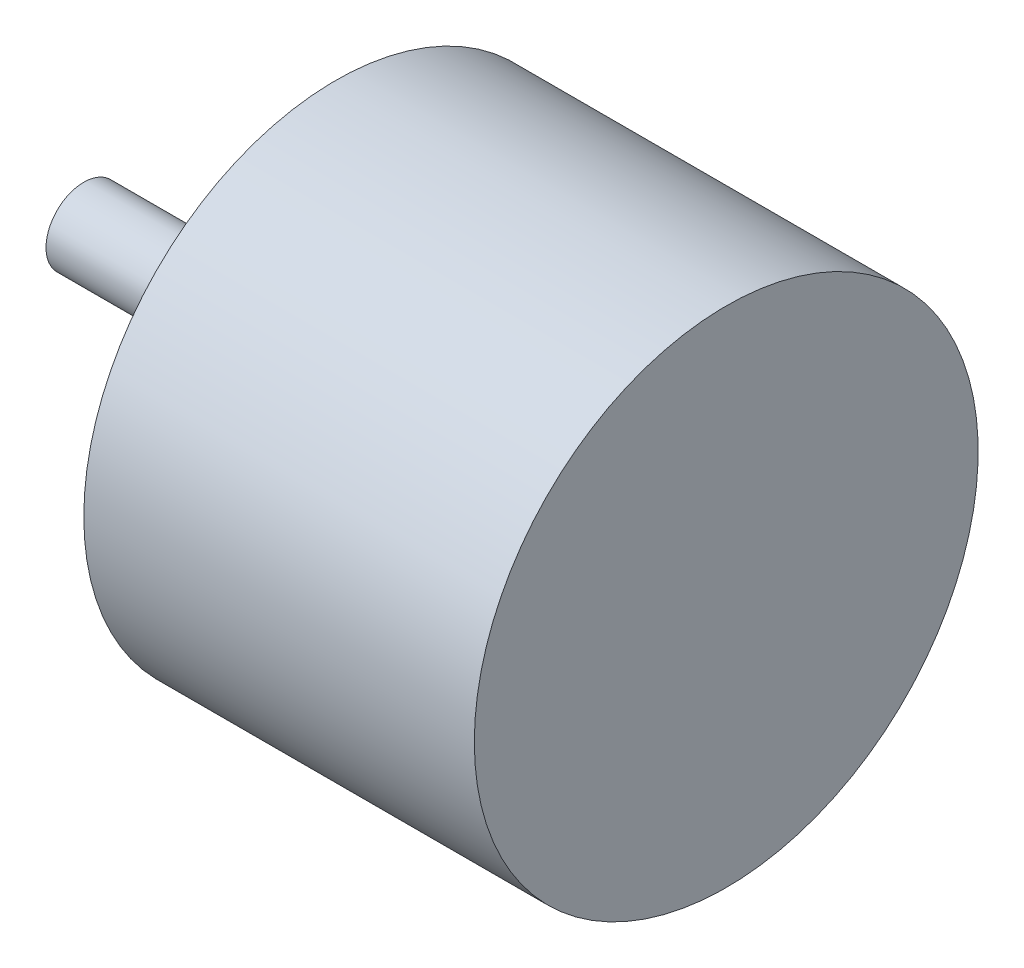
from build123d import *

# Parameters (mm, degrees)
SKETCH2_R          = 1.5
CUT_EXTRUDE1_DEPTH = 10


with BuildPart() as part:
    # Sketch1 → Revolve1 (revolve)
    with BuildSketch(Plane.XY, mode=Mode.PRIVATE) as revolve1_sk:
        Polygon((-24.5, 0), (-24.5, 3), (-9.5, 3), (-9.5, 10), (-4.5, 10), (-4.5, 20), (26.5, 20), (26.5, 0), align=None)
    revolve(revolve1_sk.sketch.rotate(Axis((-28.153846154, 0, 0), (1, 0, 0)), 90), axis=Axis((-28.153846154, 0, 0), (1, 0, 0)))

    # Sketch2 → Cut-Extrude1 (cut)
    with BuildSketch(Plane.ZY.offset(4.5)):
        with Locations((15, 0)):
            Circle(SKETCH2_R)
        with Locations((-7.5, -12.990381057)):
            Circle(SKETCH2_R)
        with Locations((-7.5, 12.990381057)):
            Circle(SKETCH2_R)
    extrude(amount=-CUT_EXTRUDE1_DEPTH, mode=Mode.SUBTRACT)


solid = part.part
